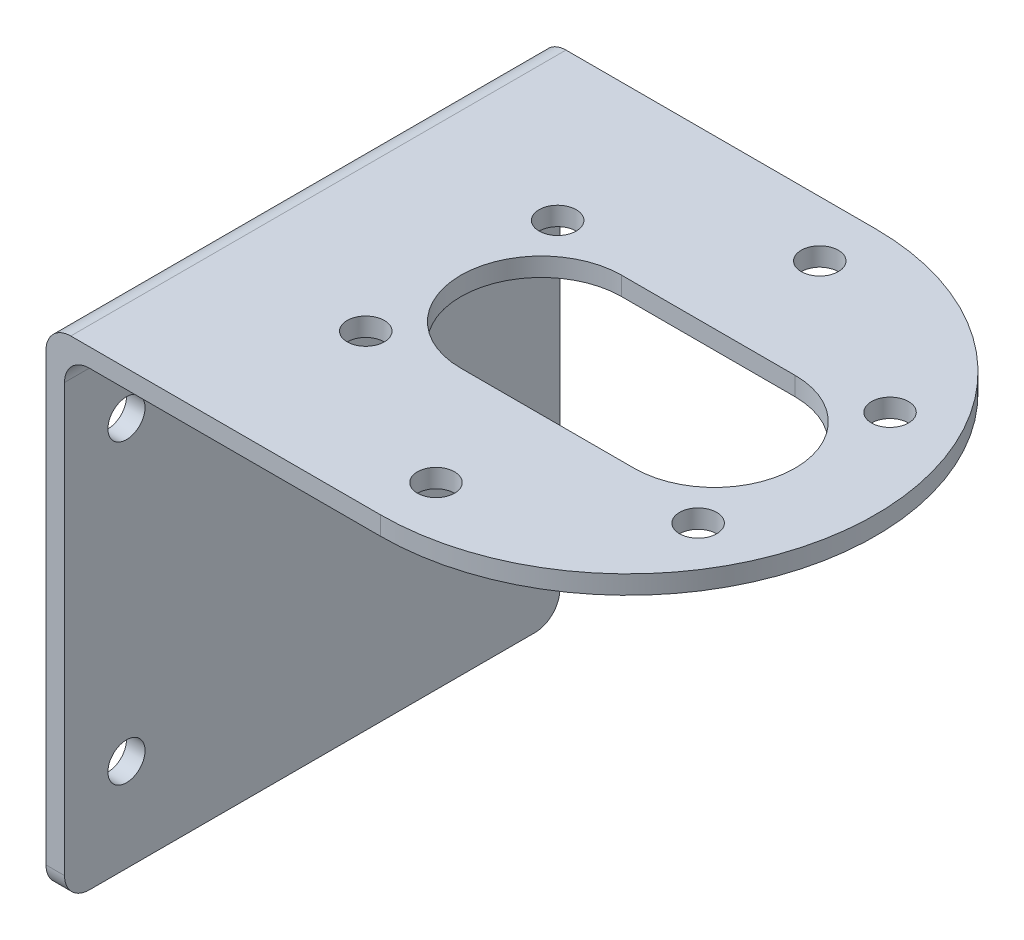
from build123d import *

# Parameters (mm, degrees)
EXTRUDE_1_DEPTH          = 20
CUT_EXTRUDE_2_DEPTH      = 40
SKETCH_4_R               = 1.5
CUT_EXTRUDE_3_DEPTH      = 40
SKETCH_5_R               = 1.5
CUT_EXTRUDE_4_DEPTH      = 40
FILLET_1_R               = 2
PATTERN_CIRCULAR_1_COUNT = 6


with BuildPart() as part:
    # 草图1 → 凸台-拉伸1 (new, symmetric)
    with BuildSketch(Plane.XY):
        with BuildLine():
            Line((0, -40), (0, -2))
            ThreePointArc((0, -2), (0.585786438, -0.585786438), (2, 0))
            Line((2, 0), (50, 0))
            Line((50, 0), (50, -1.5))
            Line((50, -1.5), (3.5, -1.5))
            ThreePointArc((3.5, -1.5), (2.085786438, -2.085786438), (1.5, -3.5))
            Line((1.5, -3.5), (1.5, -40))
            Line((1.5, -40), (0, -40))
        make_face()
    extrude(amount=EXTRUDE_1_DEPTH, both=True)

    # 草图3 → 切除-拉伸2 (cut)
    with BuildSketch(Plane.XZ.offset(1.5)):
        with BuildLine():
            Line((27, 20), (50, 20))
            Line((50, 20), (50, -20))
            Line((50, -20), (27, -20))
            ThreePointArc((27, -20), (47, 0), (27, 20))
        make_face()
        with BuildLine():
            Line((34, -6.5), (20, -6.5))
            ThreePointArc((20, -6.5), (13.5, 0), (20, 6.5))
            Line((20, 6.5), (34, 6.5))
            ThreePointArc((34, 6.5), (40.5, 0), (34, -6.5))
        make_face()
    extrude(amount=-CUT_EXTRUDE_2_DEPTH, mode=Mode.SUBTRACT)

    # 草图4 → 切除-拉伸3 (cut)
    with BuildSketch(Plane.XZ.offset(1.5)):
        with Locations(Location((27, -15.5, 0), (0, 0, 270))):
            Circle(SKETCH_4_R)
    cut_extrude_3 = extrude(amount=-CUT_EXTRUDE_3_DEPTH, mode=Mode.SUBTRACT)

    # 草图5 → 切除-拉伸4 (cut)
    with BuildSketch(Plane.ZY):
        with Locations((15, -8.5)):
            Circle(SKETCH_5_R)
        with Locations((15, -32.5)):
            Circle(SKETCH_5_R)
        with Locations((-15, -32.5)):
            Circle(SKETCH_5_R)
        with Locations((-15, -8.5)):
            Circle(SKETCH_5_R)
    extrude(amount=-CUT_EXTRUDE_4_DEPTH, mode=Mode.SUBTRACT)

    # 圆角1
    fillet_1_edges = [part.edges().sort_by_distance(p)[0] for p in [
        (0.75, -40, 20),
        (0.75, -40, -20),
    ]]
    fillet(fillet_1_edges, radius=FILLET_1_R)

    # 阵列(圆周)1: 切除-拉伸3 ×6 about axis
    pattern_circular_1_axis = Axis((27, 0, 0), (0, 1, 0))
    for i in range(1, PATTERN_CIRCULAR_1_COUNT):
        add(cut_extrude_3.rotate(pattern_circular_1_axis, i * 360 / PATTERN_CIRCULAR_1_COUNT), mode=Mode.SUBTRACT)


solid = part.part
